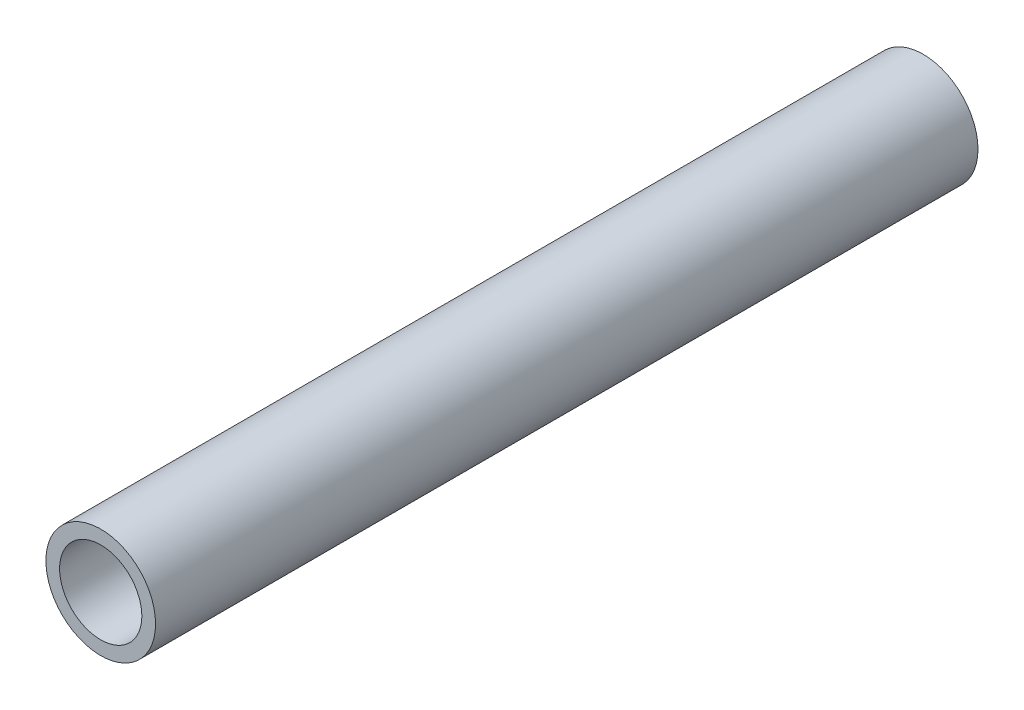
from build123d import *

# Parameters (mm, degrees)
SKETCH1_R           = 12.7
SKETCH1_R_2         = 9.525
BOSS_EXTRUDE1_DEPTH = 190.5


with BuildPart() as part:
    # Sketch1 → Boss-Extrude1 (new body)
    with BuildSketch(Plane.XY):
        Circle(SKETCH1_R)
        Circle(SKETCH1_R_2, mode=Mode.SUBTRACT)
    extrude(amount=BOSS_EXTRUDE1_DEPTH)


solid = part.part
